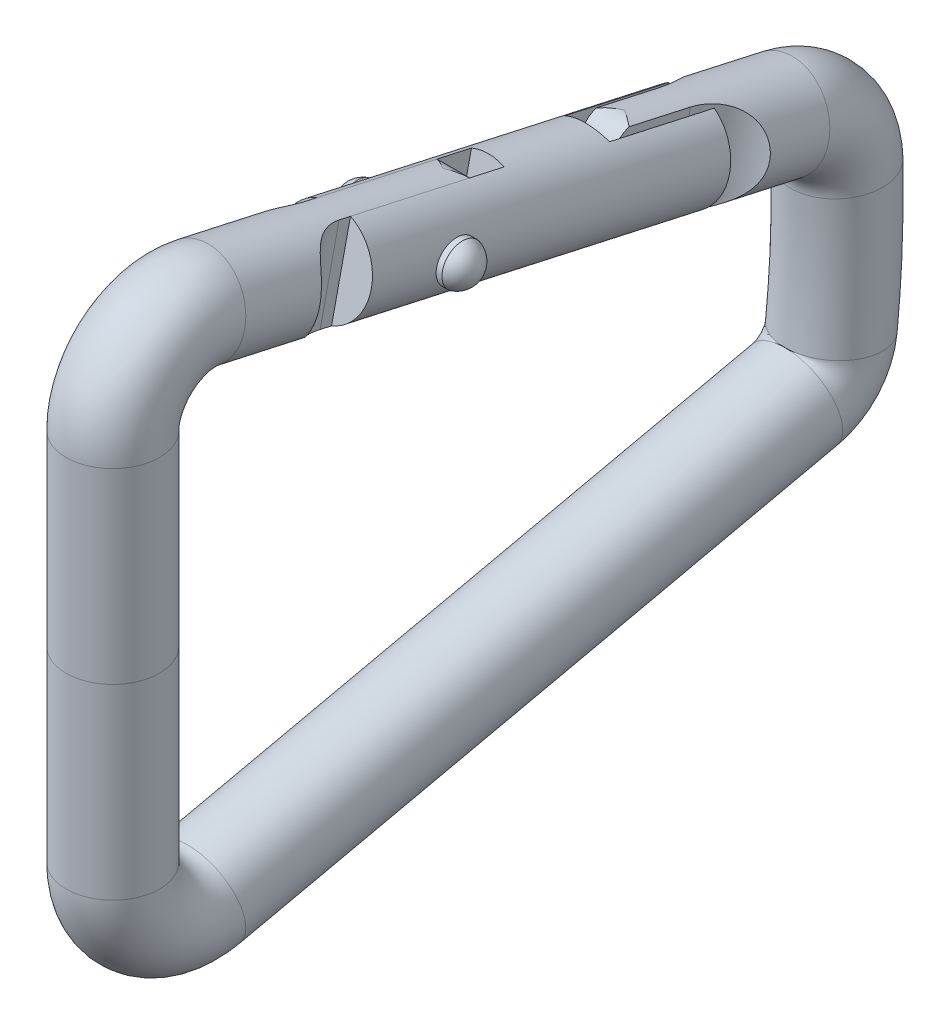
from build123d import *

# Parameters (mm, degrees)
SKETCH3_R               = 3.1750000000000056
CUT_EXTRUDE1_DEPTH      = 94.66486769225847
CUT_EXTRUDE1_DEPTH_BACK = 94.66486769225847
SKETCH5_R               = 0.7937499999999926
CUT_EXTRUDE2_DEPTH      = 3.6512499999999997
BOSS_EXTRUDE1_START     = 3.175
BOSS_EXTRUDE1_DEPTH     = 6.35
CUT_EXTRUDE3_DEPTH      = 94.66486769225847
CUT_EXTRUDE3_DEPTH_BACK = 94.66486769225847
SKETCH8_R               = 0.7937499999999926
CUT_EXTRUDE4_DEPTH      = 1.524
CUT_EXTRUDE5_START      = -24.937209041
SKETCH10_R              = 3.174999999999993
CUT_EXTRUDE5_DEPTH      = 24.937209041


with BuildPart() as part:
    # Sweep1: sweep along a path in Sketch4
    with BuildLine(Plane(origin=(0, 0, 0), x_dir=(0, 0, -1), z_dir=(1, 0, 0))) as sweep1_path:
        Line((44.687043661380166, 17.349609733908693), (84.37731273436341, 8.550488921566425))
        ThreePointArc((84.37731273436341, 8.550488921566425), (87.02102487213504, 6.930633861224587), (88.10735762919327, 4.026666673934361))
        ThreePointArc((88.10735762919327, 4.026666673934361), (88.07578745756096, -0.7879476080263652), (87.72701908752661, -5.590016743707428))
        ThreePointArc((87.72701908752661, -5.590016743707428), (86.93759821789892, -7.370825449183134), (85.25685894930672, -8.35549822016541))
        Line((85.25685894930672, -8.35549822016541), (44.68704366138021, -17.349609733908682))
        ThreePointArc((44.68704366138021, -17.349609733908682), (40.6752894637234, -16.414199850729858), (38.89374999999998, -12.7))
        Line((38.89374999999998, -12.7), (38.89374999999998, 12.699999999999998))
        ThreePointArc((38.89374999999998, 12.699999999999998), (40.67528946372339, 16.414199850729844), (44.687043661380166, 17.349609733908693))
    # Sketch3 → Sweep1 (sweep)
    with BuildSketch(Plane(origin=(0, 0, 0), x_dir=(1, 0, 0), z_dir=(0, 1, 0))):
        with Locations((0, 38.89374999999998)):
            Circle(SKETCH3_R)
    sweep(path=sweep1_path.line)

    # Sketch5 → Cut-Extrude1 (cut, two sides: drawn at the far end of the back side and taken through both)
    with BuildSketch(Plane(origin=(0, 0, 0), x_dir=(0, 0, -1), z_dir=(1, 0, 0)).offset(-CUT_EXTRUDE1_DEPTH_BACK)):
        with Locations((59.0891131180102, 14.156747804361004)):
            Circle(SKETCH5_R)
        with BuildLine():
            Line((61.326178803566556, 16.912889739840065), (73.67628330572037, 14.174937488630098))
            ThreePointArc((73.67628330572037, 14.174937488630098), (72.16225764640757, 13.69756703191706), (71.81865975928083, 12.147697120614165))
            Line((71.81865975928083, 12.147697120614165), (72.92109960602662, 8.651204632757175))
            ThreePointArc((72.92109960602662, 8.651204632757175), (73.36262581074958, 7.958147317284141), (74.0915273782127, 7.578705178167319))
            Line((74.0915273782127, 7.578705178167319), (58.16215163406039, 11.110162759879685))
            ThreePointArc((58.16215163406039, 11.110162759879685), (58.98311997790017, 11.146007011869775), (59.6761772933732, 11.58753321659273))
            Line((59.6761772933732, 11.58753321659273), (62.1530086886259, 14.290520373947318))
            ThreePointArc((62.1530086886259, 14.290520373947318), (62.49660657575263, 15.840390285250212), (61.326178803566556, 16.912889739840065))
        make_face()
    extrude(amount=CUT_EXTRUDE1_DEPTH + CUT_EXTRUDE1_DEPTH_BACK, mode=Mode.SUBTRACT)

    # Sketch6 → Cut-Extrude2 (cut, symmetric)
    with BuildSketch(Plane(origin=(0, 25.97962842614991, -5.759544959524065), x_dir=(0, 0.21643961393809674, 0.9762960071199348), z_dir=(0, 0.9762960071199348, -0.21643961393809674))):
        with BuildLine():
            Line((-57.79938417197661, 1.1112499999999998), (-57.79938417197661, 3.1750000000000056))
            Line((-57.79938417197661, 3.1750000000000056), (-45.09938417197662, 3.1750000000000056))
            ThreePointArc((-45.09938417197662, 3.1750000000000056), (-46.15661273749682, 1.683126750242741), (-47.89338417197662, 1.1112499999999998))
            Line((-47.89338417197662, 1.1112499999999998), (-57.79938417197661, 1.1112499999999998))
        make_face()
        with BuildLine():
            Line((-57.79938417197661, -1.1112499999999998), (-57.79938417197661, -3.1750000000000056))
            Line((-57.79938417197661, -3.1750000000000056), (-45.09938417197662, -3.1750000000000056))
            ThreePointArc((-45.09938417197662, -3.1750000000000056), (-46.15661273749682, -1.6831267502427436), (-47.893384171976614, -1.1112499999999998))
            Line((-47.893384171976614, -1.1112499999999998), (-57.79938417197661, -1.1112499999999998))
        make_face()
        with BuildLine():
            Line((-67.27434321317615, 1.1112499999999998), (-67.27434321317615, 3.1750000000000056))
            Line((-67.27434321317615, 3.1750000000000056), (-76.41834321317616, 3.1750000000000056))
            ThreePointArc((-76.41834321317616, 3.1750000000000056), (-74.63333202745872, 1.6567470272589677), (-72.35434321317616, 1.1112499999999998))
            Line((-72.35434321317616, 1.1112499999999998), (-67.27434321317615, 1.1112499999999998))
        make_face()
        with BuildLine():
            Line((-67.27434321317615, -1.1112499999999998), (-67.27434321317615, -3.1750000000000056))
            Line((-67.27434321317615, -3.1750000000000056), (-76.41834321317616, -3.1750000000000056))
            ThreePointArc((-76.41834321317616, -3.1750000000000056), (-74.63333202745872, -1.6567470272589722), (-72.35434321317618, -1.1112499999999994))
            Line((-72.35434321317618, -1.1112499999999994), (-67.27434321317615, -1.1112499999999998))
        make_face()
    extrude(amount=CUT_EXTRUDE2_DEPTH, both=True, mode=Mode.SUBTRACT)


with BuildPart() as body_2:
    # Sketch7 → Boss-Extrude1 (new body)
    with BuildSketch(Plane(origin=(0, 25.97962842614991, -5.759544959524065), x_dir=(0, 0.21643961393809674, 0.9762960071199348), z_dir=(0, 0.9762960071199348, -0.21643961393809674)).offset(BOSS_EXTRUDE1_START)):
        Polygon((-73.62434321317615, 3.1750000000000056), (-73.62434321317615, -3.1750000000000056), (-48.68713417197662, -3.1750000000000056), (-48.68713417197662, -1.1112499999999998), (-59.386884171976625, -1.1112499999999998), (-59.386884171976625, 1.1112499999999985), (-48.68713417197662, 1.1112499999999998), (-48.68713417197662, 3.1750000000000056), align=None)
    extrude(amount=-BOSS_EXTRUDE1_DEPTH)

    # Sketch8 → Cut-Extrude3 (cut, two sides: drawn at the far end of the back side and taken through both)
    with BuildSketch(Plane(origin=(0, 0, 0), x_dir=(0, 0, -1), z_dir=(1, 0, 0)).offset(-CUT_EXTRUDE3_DEPTH_BACK)):
        with Locations((59.0891131180102, 14.156747804361004)):
            Circle(SKETCH8_R)
    extrude(amount=CUT_EXTRUDE3_DEPTH + CUT_EXTRUDE3_DEPTH_BACK, mode=Mode.SUBTRACT)

    # Sketch9 → Cut-Extrude4 (cut, symmetric)
    with BuildSketch(Plane(origin=(0, 0, 0), x_dir=(0, 0, -1), z_dir=(1, 0, 0))):
        Polygon((78.32589303962907, 13.144143827249914), (76.95150149112216, 6.94466418203833), (73.19670956771309, 7.777081510792922), (70.99182987422152, 14.770066486506908), align=None)
    extrude(amount=CUT_EXTRUDE4_DEPTH, both=True, mode=Mode.SUBTRACT)

    # Sketch10 → Cut-Extrude5 (cut)
    with BuildSketch(Plane(origin=(0, -10.537824523934948, -47.53305469021334), x_dir=(1, 0, 0), z_dir=(0, 0.21643961393809663, 0.9762960071199348)).offset(CUT_EXTRUDE5_START)):
        Polygon((-3.8099999999999996, 30.420401186408206), (3.8099999999999947, 30.420401186408206), (3.8099999999999943, 22.8004011864082), (-3.8099999999999943, 22.8004011864082), align=None)
        with Locations(Location((0, 26.610401186408204, 0), (0, 0, 290.487315115))):
            Circle(SKETCH10_R, mode=Mode.SUBTRACT)
    extrude(amount=CUT_EXTRUDE5_DEPTH, mode=Mode.SUBTRACT)


with BuildPart() as body_3:
    # Sketch11 → Revolve1 (revolve)
    with BuildSketch(Plane(origin=(0, 25.97962842614991, -5.759544959524065), x_dir=(0, 0.21643961393809674, 0.9762960071199348), z_dir=(0, 0.9762960071199348, -0.21643961393809674))):
        with BuildLine():
            Line((-55.41813417197661, 3.175000000002035), (-55.41813417197661, -3.174999999999993))
            Line((-55.41813417197661, -3.174999999999993), (-56.02138417197663, -3.174999999999993))
            Line((-56.02138417197663, -3.174999999999993), (-56.02138417197663, -3.5718749999999932))
            ThreePointArc((-56.02138417197663, -3.5718749999999932), (-55.502294637318194, -4.33933109626952), (-54.62438417197662, -4.635499999999999))
            Line((-54.62438417197662, -4.635499999999999), (-54.62438417197662, 4.6355))
            ThreePointArc((-54.62438417197662, 4.6355), (-55.502294637318194, 4.339331096269521), (-56.02138417197663, 3.5718749999999932))
            Line((-56.02138417197663, 3.5718749999999932), (-56.02138417197663, 3.174999999999993))
            Line((-56.02138417197663, 3.174999999999993), (-55.41813417197661, 3.175000000002035))
        make_face()
    revolve(axis=Axis((-4.6354999999999995, 14.156747804361009, -59.08911311801021), (1, 0, 0)))


solid = Compound([part.part, body_2.part, body_3.part])
